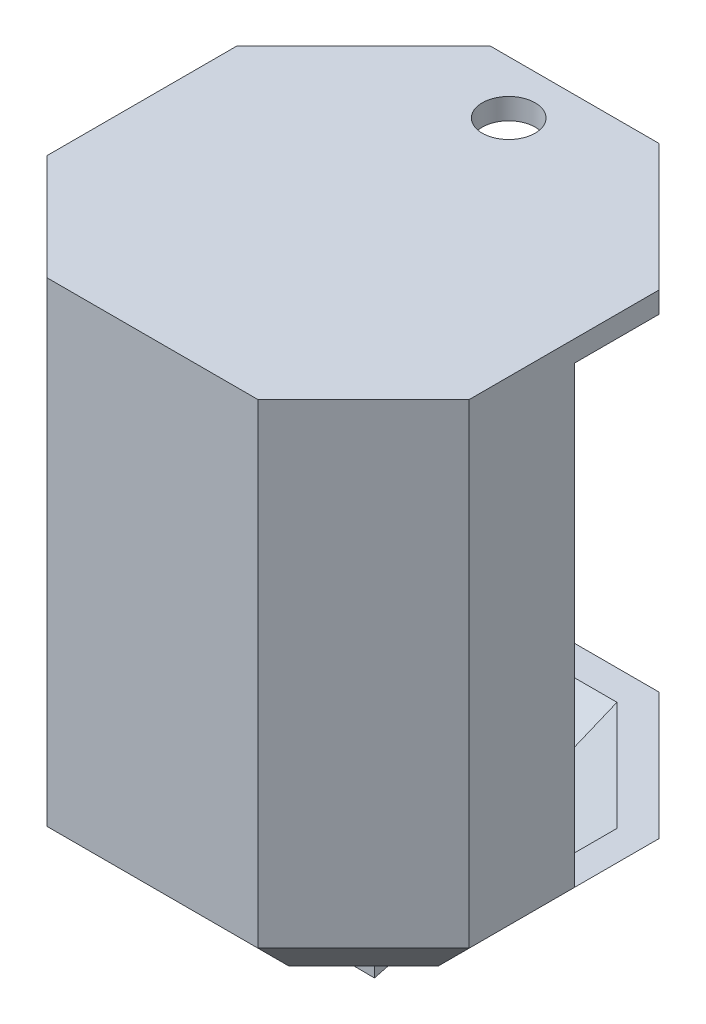
from build123d import *

# Parameters (mm, degrees)
SKETCH1_W               = 40
SKETCH1_H               = 50
BOSS_EXTRUDE1_DEPTH     = 40
CHAMFER1_SIZE           = 10
CHAMFER2_SIZE           = 12
CHAMFER4_SIZE           = 5
BOSS_EXTRUDE2_DEPTH     = 4
CHAMFER5_SIZE           = 2
SHELL1_T                = -2
SKETCH3_W               = 45
SKETCH3_H               = 43
CUT_EXTRUDE1_DEPTH      = 20
CUT_EXTRUDE2_DEPTH      = 69.585712798
CUT_EXTRUDE2_DEPTH_BACK = 10
SKETCH4_R               = 2.5
BOSS_EXTRUDE3_DEPTH     = 2


with BuildPart() as part:
    # Sketch1 → Boss-Extrude1 (new body)
    with BuildSketch(Plane.XY):
        Rectangle(SKETCH1_W, SKETCH1_H)
    extrude(amount=BOSS_EXTRUDE1_DEPTH)

    # Chamfer1
    chamfer1_edges = [part.edges().sort_by_distance(p)[0] for p in [
        (-20, 0, 40),
        (20, 0, 40),
    ]]
    chamfer(chamfer1_edges, length=CHAMFER1_SIZE)

    # Chamfer2
    chamfer2_edges = [part.edges().sort_by_distance(p)[0] for p in [
        (-20, 0, 0),
        (20, 0, 0),
    ]]
    chamfer(chamfer2_edges, length=CHAMFER2_SIZE)

    # Chamfer4
    chamfer4_edges = [part.edges().sort_by_distance(p)[0] for p in [
        (0, -25, 40),
        (20, -25, 21),
        (-20, -25, 21),
        (15, -25, 35),
        (-15, -25, 35),
        (0, -25, 0),
        (14, -25, 6),
        (-14, -25, 6),
    ]]
    chamfer(chamfer4_edges, length=CHAMFER4_SIZE)

    # Sketch2 → Boss-Extrude2 (add)
    with BuildSketch(Plane.XZ.offset(25)):
        Polygon((6.272077939, 31), (-6.272077939, 31), (-11, 26.272077939), (-11, 15.727922061), (-4.272077939, 9), (4.272077939, 9), (11, 15.727922061), (11, 26.272077939), align=None)
    extrude(amount=BOSS_EXTRUDE2_DEPTH)

    # Chamfer5
    chamfer5_edges = [part.edges().sort_by_distance(p)[0] for p in [
        (8.636038969, -29, 28.636038969),
        (0, -29, 31),
        (-8.636038969, -29, 28.636038969),
        (-11, -29, 21),
        (-7.636038969, -29, 12.363961031),
        (0, -29, 9),
        (7.636038969, -29, 12.363961031),
        (11, -29, 21),
    ]]
    chamfer(chamfer5_edges, length=CHAMFER5_SIZE)

    # Shell1
    shell1_openings = [part.faces().sort_by_distance(p)[0] for p in [
        (0, 2.5, 0),
    ]]
    offset(amount=SHELL1_T, openings=shell1_openings, kind=Kind.INTERSECTION)

    # Sketch3 → Cut-Extrude1 (cut)
    with BuildSketch(Plane(origin=(0, 0, 0), x_dir=(-1, 0, 0), z_dir=(0, 0, -1))):
        with Locations((-2.5, 1.5)):
            Rectangle(SKETCH3_W, SKETCH3_H)
    extrude(amount=-CUT_EXTRUDE1_DEPTH, mode=Mode.SUBTRACT)

    # Sketch4 → Cut-Extrude2 (cut, two sides: drawn at the far end of the back side and taken through both)
    with BuildSketch(Plane.XZ.offset(-23).offset(-CUT_EXTRUDE2_DEPTH_BACK)):
        with Locations(Location((-1.222653688, 5.030872217, 0), (0, 0, 161.396212333))):
            Circle(SKETCH4_R)
    extrude(amount=CUT_EXTRUDE2_DEPTH + CUT_EXTRUDE2_DEPTH_BACK, mode=Mode.SUBTRACT)

    # Sketch5 → Boss-Extrude3 (add)
    # profile 1 of 8: a face of its own
    with BuildSketch(Plane.XZ.offset(29)):
        Polygon((-3.907968564, 25.873424225), (-1.8521612, 26.578618027), (2.162403013, 26.578618027), (4.206288315, 25.839581431), (4.183149683, 24.513463944), (0.17410729, 21.92507617), (-3.70376403, 24.56651521), align=None)
        Polygon((-1.267927635, 24.828885337), (1.687291293, 24.828885337), (1.687291293, 24.58450637), (0.167260904, 23.603117877), (-1.267927635, 24.580706539), align=None, mode=Mode.SUBTRACT)
    # profile 2 of 8: a face of its own
    with BuildSketch(Plane.XZ.offset(29)):
        Polygon((-6.640454007, 25.873424225), (-4.222410504, 25.873424225), (-3.990642578, 24.390109498), (-1.452911939, 22.661516611), (-1.008516208, 19.817383934), (-3.786282946, 20.257943712), (-5.746633086, 21.646373557), align=None)
        Polygon((-5.179729537, 24.26393897), (-5.179729537, 23.810064286), (-2.37123808, 21.924837325), (-2.37123808, 22.426829117), align=None, mode=Mode.SUBTRACT)
        Polygon((-4.974230162, 23.056566578), (-4.974230162, 22.684710567), (-2.175342033, 20.805929932), (-2.175342033, 21.167929466), align=None, mode=Mode.SUBTRACT)
    # profile 3 of 8: a face of its own
    with BuildSketch(Plane.XZ.offset(29)):
        Polygon((0.175518811, 21.579113739), (-1.194872838, 22.512565549), (-0.754201781, 19.692270785), (-0.754201781, 16.336897736), (1.148015733, 16.336897736), (1.148015733, 19.6551114), (1.568514987, 22.478484191), align=None)
    # profile 4 of 8: a face of its own
    with BuildSketch(Plane.XZ.offset(29)):
        Polygon((-5.371925401, 21.102931741), (-5.040352094, 15.872748244), (-2.918674263, 14.004045062), (-2.918674263, 18.883324606), (-3.897566255, 19.36360058), (-3.897566255, 20.051937661), align=None)
    # profile 5 of 8: a face of its own
    with BuildSketch(Plane.XZ.offset(29)):
        Polygon((-2.57777667, 18.638279212), (-2.57777667, 13.829972979), (-1.787898039, 13.134274183), (-0.948144856, 15.171513794), (1.44618133, 15.171513794), (2.140445472, 13.131762403), (2.958479742, 13.727080014), (2.958479742, 18.581830676), (1.348015733, 19.245666323), (1.348015733, 16.136897736), (-0.954201781, 16.136897736), (-0.954201781, 19.321874117), align=None)
    # profile 6 of 8: a face of its own
    with BuildSketch(Plane.XZ.offset(29)):
        Polygon((-1.452207759, 13.131762403), (1.872175521, 13.131762403), (1.225826325, 14.867356635), (-0.822603437, 14.867356635), align=None)
    # profile 7 of 8: a face of its own
    with BuildSketch(Plane.XZ.offset(29)):
        Polygon((4.147969201, 20.290315345), (6.096924719, 21.694695099), (6.956223847, 25.928898472), (4.538260846, 25.909167636), (4.318604239, 24.424011104), (1.795063119, 22.674768301), (1.373889836, 19.827104116), align=None)
        Polygon((2.719369869, 21.945606931), (2.715273698, 22.447582011), (5.508681142, 24.307547529), (5.512384685, 23.853687956), align=None, mode=Mode.SUBTRACT)
        Polygon((2.532610443, 20.825138309), (2.529656587, 21.187125792), (5.313040568, 23.098538493), (5.316074852, 22.726694861), align=None, mode=Mode.SUBTRACT)
    # profile 8 of 8: a face of its own
    with BuildSketch(Plane.XZ.offset(29)):
        Polygon((4.266546498, 19.396910041), (4.260929781, 20.085224205), (5.726663904, 21.148213823), (5.43777907, 15.915498866), (3.331420184, 14.029545356), (3.291606068, 18.908662459), align=None)
    extrude(amount=BOSS_EXTRUDE3_DEPTH)


solid = part.part
